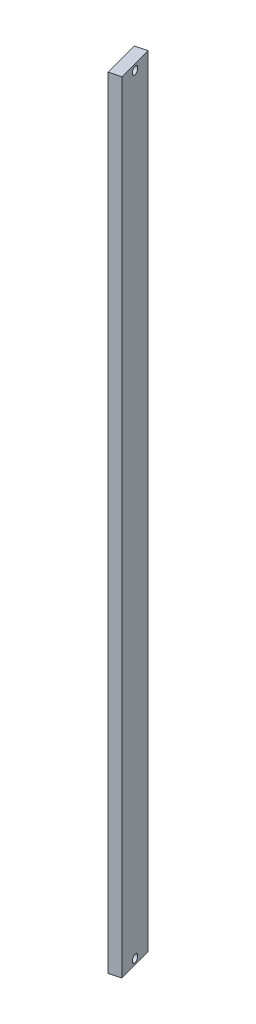
from build123d import *

# Parameters (mm, degrees)
BOSS_EXTRUDE1_DEPTH = 431.8
SKETCH2_R           = 2.0955
CUT_EXTRUDE1_DEPTH  = 433.042370256
SKETCH3_R           = 2.0955
CUT_EXTRUDE2_DEPTH  = 433.042370256


with BuildPart() as part:
    # Sketch1 → Boss-Extrude1 (new body)
    with BuildSketch(Plane(origin=(0, 0, 0), x_dir=(1, 0, 0), z_dir=(0, 1, 0))):
        Polygon((39.444022474, 0), (45.577651471, 1.643500936), (40.293154487, 21.365512173), (34.15952549, 19.722011237), align=None)
    extrude(amount=BOSS_EXTRUDE1_DEPTH)

    # Sketch2 → Cut-Extrude1 (cut, through all)
    with BuildSketch(Plane(origin=(36.801773982, 0, -9.861005618), x_dir=(0.25881904510252096, 0, 0.9659258262890683), z_dir=(-0.9659258262890683, 0, 0.25881904510252096))):
        with Locations((0, 428.625)):
            Circle(SKETCH2_R)
    extrude(amount=-CUT_EXTRUDE1_DEPTH, mode=Mode.SUBTRACT)

    # Sketch3 → Cut-Extrude2 (cut, through all)
    with BuildSketch(Plane(origin=(36.801773982, 0, -9.861005618), x_dir=(0.25881904510252096, 0, 0.9659258262890683), z_dir=(-0.9659258262890683, 0, 0.25881904510252096))):
        with Locations((0, 3.175)):
            Circle(SKETCH3_R)
    extrude(amount=-CUT_EXTRUDE2_DEPTH, mode=Mode.SUBTRACT)


solid = part.part
